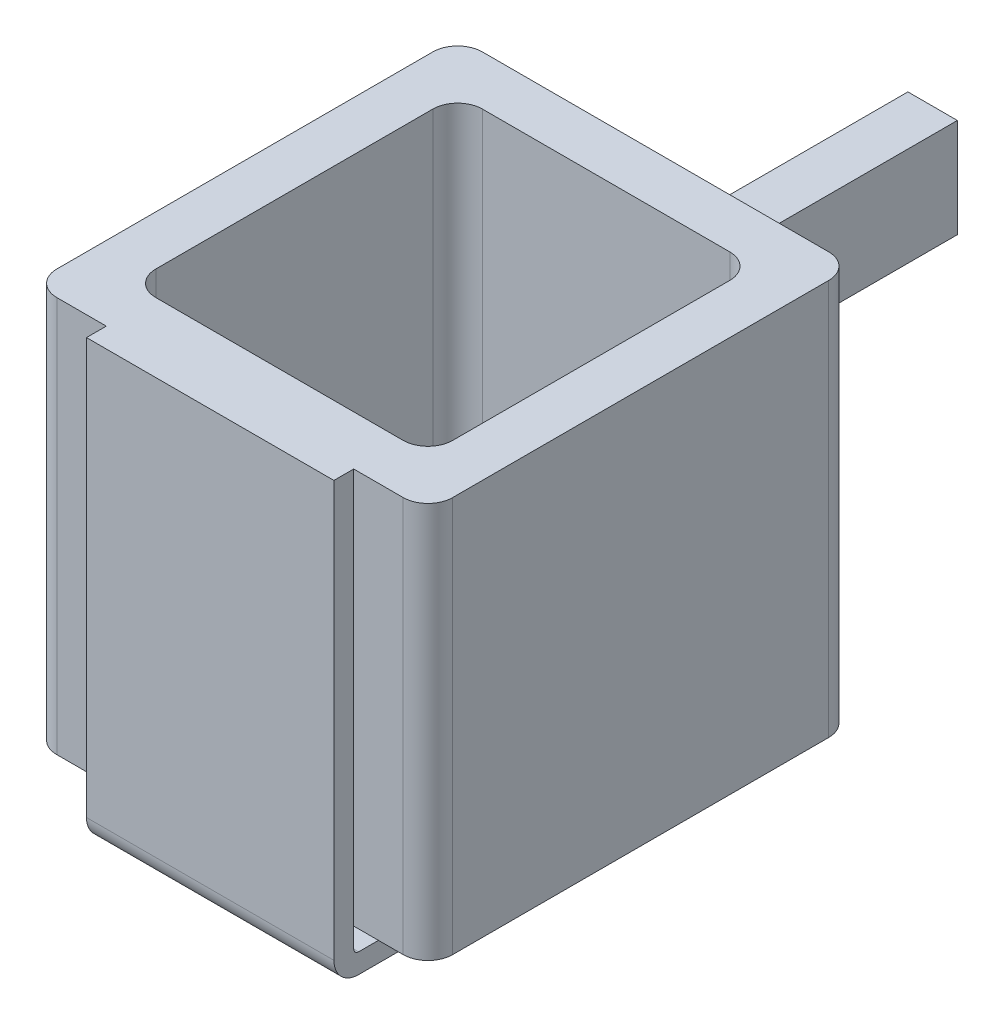
from build123d import *

# Parameters (mm, degrees)
SKETCH_1_W          = 4
SKETCH_1_H          = 4.5
EXTRUDE_1_DEPTH     = 4
SKETCH_2_W          = 0.75
SKETCH_2_H          = 0.2
CUT_EXTRUDE_1_DEPTH = 7.34428877
SKETCH_3_W          = 0.75
SKETCH_3_H          = 0.2
CUT_EXTRUDE_2_DEPTH = 4
SKETCH_4_W          = 2.5
SKETCH_4_H          = 0.2
EXTRUDE_2_DEPTH     = 0.45
SKETCH_5_W          = 2.5
SKETCH_5_H          = 0.2
EXTRUDE_3_DEPTH     = 1.707300918
SKETCH_6_W          = 3
SKETCH_6_H          = 3.3
CUT_EXTRUDE_3_DEPTH = 7.34428877
SKETCH_7_W          = 2.5
SKETCH_7_H          = 0.2
EXTRUDE_4_DEPTH     = 2.968221289
EXTRUDE_5_DEPTH     = 1
CHAMFER_1_SIZE      = 0.070710678
FILLET_1_R          = 0.05
CHAMFER_2_SIZE      = 0.2
FILLET_2_R          = 0.25


with BuildPart() as part:
    # Эскиз1 → Бобышка-Вытянуть1 (new body)
    with BuildSketch(Plane(origin=(-2, 0, 0), x_dir=(0, -1, 0), z_dir=(-1, 0, 0))):
        with Locations((0, 2.25)):
            Rectangle(SKETCH_1_W, SKETCH_1_H)
    extrude(amount=-EXTRUDE_1_DEPTH)

    # Эскиз2 → Вырез-Вытянуть1 (cut, through all)
    with BuildSketch(Plane.XZ.offset(2)):
        with Locations((-1.625, 4.4)):
            Rectangle(SKETCH_2_W, SKETCH_2_H)
    extrude(amount=-CUT_EXTRUDE_1_DEPTH, mode=Mode.SUBTRACT)

    # Эскиз3 → Вырез-Вытянуть2 (cut)
    with BuildSketch(Plane.XZ.offset(2)):
        with Locations((1.625, 4.4)):
            Rectangle(SKETCH_3_W, SKETCH_3_H)
    extrude(amount=-CUT_EXTRUDE_2_DEPTH, mode=Mode.SUBTRACT)

    # Эскиз4 → Бобышка-Вытянуть2 (add)
    with BuildSketch(Plane.XZ.offset(2)):
        with Locations((0, 4.4)):
            Rectangle(SKETCH_4_W, SKETCH_4_H)
    extrude(amount=EXTRUDE_2_DEPTH)

    # Эскиз5 → Бобышка-Вытянуть3 (add)
    with BuildSketch(Plane(origin=(0, 0, 4.3), x_dir=(-1, 0, 0), z_dir=(0, 0, -1))):
        with Locations((0, -2.35)):
            Rectangle(SKETCH_5_W, SKETCH_5_H)
    extrude(amount=EXTRUDE_3_DEPTH)

    # Эскиз6 → Вырез-Вытянуть3 (cut, through all)
    with BuildSketch(Plane.XZ.offset(2)):
        with Locations((0, 2.15)):
            Rectangle(SKETCH_6_W, SKETCH_6_H)
    extrude(amount=-CUT_EXTRUDE_3_DEPTH, mode=Mode.SUBTRACT)

    # Эскиз7 → Бобышка-Вытянуть4 (add)
    with BuildSketch(Plane(origin=(0, -2.25, 0), x_dir=(-1, 0, 0), z_dir=(0, 1, 0))):
        with Locations((0, 2.692699082)):
            Rectangle(SKETCH_7_W, SKETCH_7_H)
    extrude(amount=EXTRUDE_4_DEPTH)

    # Эскиз8 → Бобышка-Вытянуть5 (add)
    with BuildSketch(Plane.XZ):
        Polygon((-0.25, 0), (-0.25, -2.8), (0, -3.05), (0.25, -2.8), (0.25, 0), align=None)
    extrude(amount=-EXTRUDE_5_DEPTH)

    # Фаска1
    chamfer_1_edges = [part.edges().sort_by_distance(p)[0] for p in [
        (0, 0.5, -3.05),
    ]]
    chamfer(chamfer_1_edges, length=CHAMFER_1_SIZE)

    # Скругление1
    fillet_1_edges = [part.edges().sort_by_distance(p)[0] for p in [
        (0, -2.25, 4.3),
        (0, -2.25, 2.792699082),
    ]]
    fillet(fillet_1_edges, radius=FILLET_1_R)

    # Фаска2
    chamfer_2_edges = [part.edges().sort_by_distance(p)[0] for p in [
        (0, 1, -3),
        (0, 0, -3),
    ]]
    chamfer(chamfer_2_edges, length=CHAMFER_2_SIZE)

    # Скругление2
    fillet_2_edges = [part.edges().sort_by_distance(p)[0] for p in [
        (2, 0, 0),
        (-2, 0, 4.3),
        (2, 0, 4.3),
        (0, -2.45, 4.5),
        (-2, 0, 0),
        (0, -2.45, 2.592699082),
        (-1.5, 0, 0.5),
        (-1.5, 0, 3.8),
        (1.5, 0, 3.8),
        (1.5, 0, 0.5),
    ]]
    fillet(fillet_2_edges, radius=FILLET_2_R)


solid = part.part
